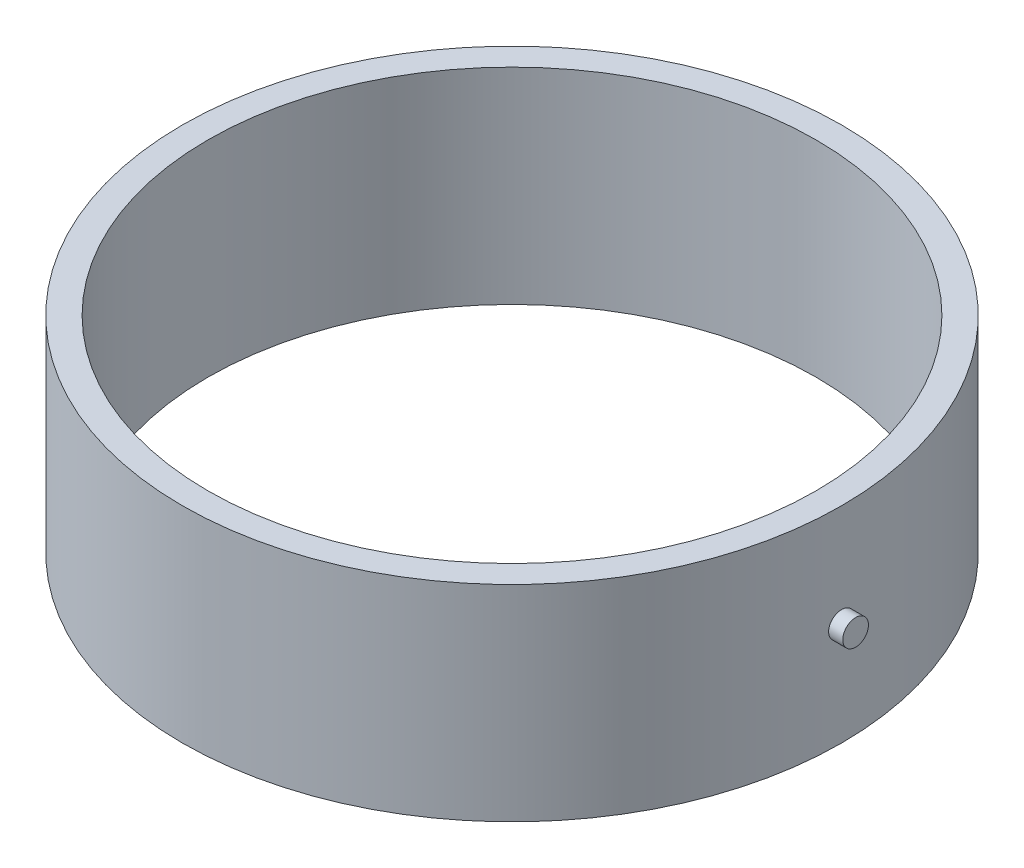
from build123d import *

# Parameters (mm, degrees)
SKETCH1_R           = 1955.8
SKETCH1_R_2         = 1803.4
BOSS_EXTRUDE1_DEPTH = 609.6
BOSS_EXTRUDE2_START = -76.2
SKETCH2_R           = 76.2
BOSS_EXTRUDE2_DEPTH = 158.75


with BuildPart() as part:
    # Sketch1 → Boss-Extrude1 (new, symmetric)
    with BuildSketch(Plane(origin=(0, 0, 0), x_dir=(1, 0, 0), z_dir=(0, 1, 0))):
        with Locations(Location((0, 0, 0), (0, 0, 90))):
            Circle(SKETCH1_R)
        with Locations(Location((0, 0, 0), (0, 0, 90))):
            Circle(SKETCH1_R_2, mode=Mode.SUBTRACT)
    extrude(amount=BOSS_EXTRUDE1_DEPTH, both=True)

    # Sketch2 → Boss-Extrude2 (add)
    with BuildSketch(Plane.ZY.offset(1955.8).offset(BOSS_EXTRUDE2_START)):
        Circle(SKETCH2_R)
    boss_extrude2 = extrude(amount=BOSS_EXTRUDE2_DEPTH)

    # Mirror1: Boss-Extrude2 across plane
    add(boss_extrude2.mirror(Plane(origin=(0, 0, 0), x_dir=(0, 0, 1), z_dir=(1, 0, 0))))


solid = part.part
